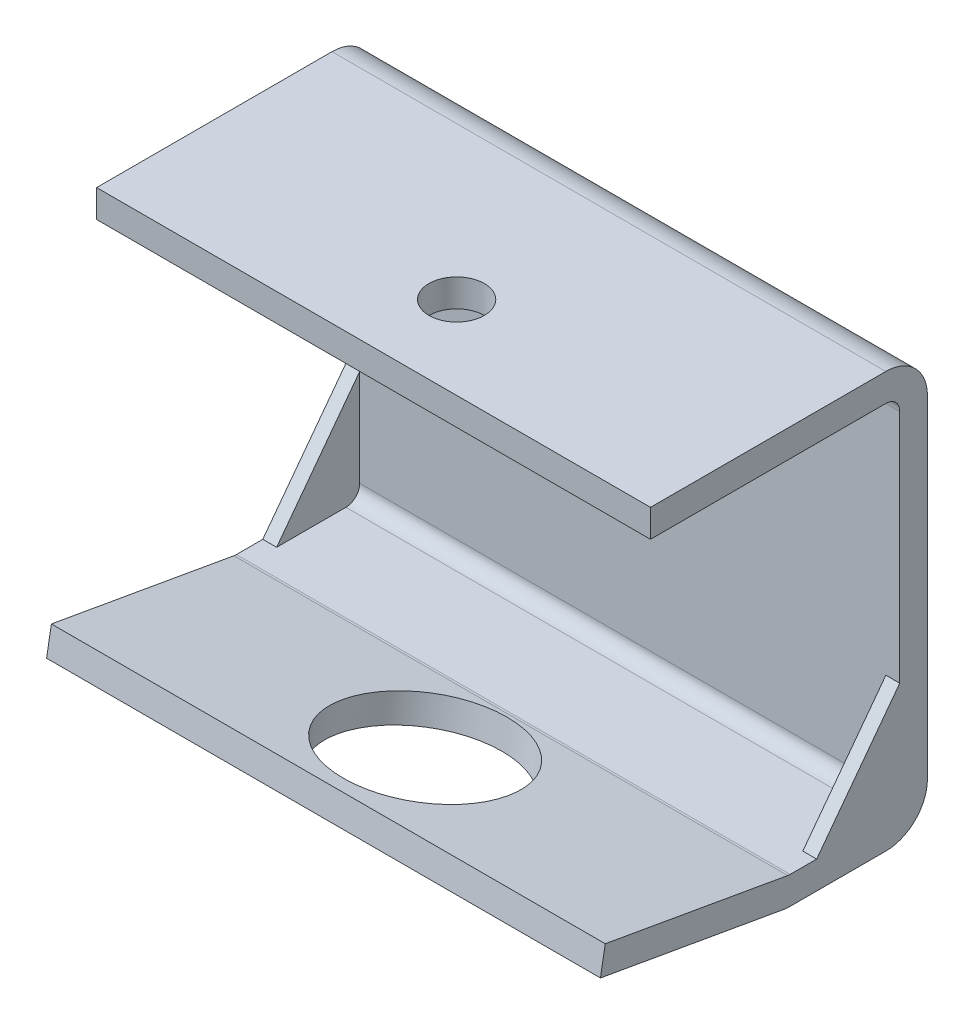
from build123d import *

# Parameters (mm, degrees)
BASE_EXTRUDE_THIN_DEPTH = 63.5
CUT_EXTRUDE1_REACH      = 135.471
SKETCH2_R               = 6.35
BOSS_EXTRUDE1_DEPTH     = 3.175
D_GAGEMENT_00001_D      = 25.4
D_GAGEMENT_00001_DEPTH  = 6.35
D_GAGEMENT_00001_TIP    = 7.630929862
ESQUISSE3_R             = 19.05
ENL_V_MAT_EXTRU_1_DEPTH = 132.649844576


with BuildPart() as part:
    # Sketch1 → Base-Extrude-Thin (new, symmetric)
    with BuildSketch(Plane(origin=(0, 0, 0), x_dir=(0, 0, -1), z_dir=(1, 0, 0))):
        with BuildLine():
            Line((-67.523772904, 7.427557692), (-25.673556457, 0.048235384))
            ThreePointArc((-25.673556457, 0.048235384), (-25.398942977, 0.012081834), (-25.122223493, 0))
            Line((-25.122223493, 0), (-3.175, 0))
            ThreePointArc((-3.175, 0), (-0.92993597, 0.92993597), (0, 3.175))
            Line((0, 3.175), (0, 79.375))
            ThreePointArc((0, 79.375), (-0.92993597, 81.62006403), (-3.175, 82.55))
            Line((-3.175, 82.55), (-57.15, 82.55))
            Line((-57.15, 82.55), (-57.15, 88.9))
            Line((-57.15, 88.9), (-3.175, 88.9))
            ThreePointArc((-3.175, 88.9), (3.560192091, 86.110192091), (6.35, 79.375))
            Line((6.35, 79.375), (6.35, 3.175))
            ThreePointArc((6.35, 3.175), (3.560192091, -3.560192091), (-3.175, -6.35))
            Line((-3.175, -6.35), (-25.122223493, -6.35))
            ThreePointArc((-25.122223493, -6.35), (-25.952381943, -6.313754499), (-26.776222386, -6.205293847))
            Line((-26.776222386, -6.205293847), (-68.626438832, 1.174028461))
            Line((-68.626438832, 1.174028461), (-67.523772904, 7.427557692))
        make_face()
    extrude(amount=BASE_EXTRUDE_THIN_DEPTH, both=True)

    # Sketch2 → Cut-Extrude1 (cut, up to next)
    with BuildSketch(Plane(origin=(0, 88.9, 0), x_dir=(-1, 0, 0), z_dir=(0, 1, 0)), mode=Mode.PRIVATE) as cut_extrude1_sk1:
        with Locations(Location((0, 38.1, 0), (0, 0, 90))):
            Circle(SKETCH2_R)
    cut_extrude1_tool1 = extrude(cut_extrude1_sk1.sketch, amount=-CUT_EXTRUDE1_REACH, mode=Mode.PRIVATE) & part.part
    add(cut_extrude1_tool1.solids().sort_by_distance((0, 88.9, 38.1))[0], mode=Mode.SUBTRACT)

    # Sketch3 → Boss-Extrude1 (add)
    with BuildSketch(Plane(origin=(63.5, 0, 0), x_dir=(0, 0, -1), z_dir=(1, 0, 0))):
        with BuildLine():
            Line((-19.05, 0), (-3.175, 0))
            ThreePointArc((-3.175, 0), (-0.92993597, 0.92993597), (0, 3.175))
            Line((0, 3.175), (0, 25.4))
            Line((0, 25.4), (-19.05, 0))
        make_face()
    boss_extrude1 = extrude(amount=-BOSS_EXTRUDE1_DEPTH)

    # Mirror1: Boss-Extrude1 across plane
    add(boss_extrude1.mirror(Plane(origin=(0, 0, 0), x_dir=(0, 0, 1), z_dir=(1, 0, 0))))

    # Dégagement #00001
    with Locations(Plane(origin=(0, -4.34365582, 0.765903716), x_dir=(-1, 0, 0), z_dir=(0, 0.9848077530122081, -0.17364817766693075))):
        with Locations((-4.206462063, 49.405030417)):
            Hole(D_GAGEMENT_00001_D / 2, depth=D_GAGEMENT_00001_DEPTH)
            with Locations((0, 0, -(D_GAGEMENT_00001_DEPTH + D_GAGEMENT_00001_TIP / 2))):  # 118° drill point
                Cone(0, D_GAGEMENT_00001_D / 2, D_GAGEMENT_00001_TIP, mode=Mode.SUBTRACT)

    # Esquisse3 → Enlèv. mat.-Extru.1 (cut, through all)
    with BuildSketch(Plane(origin=(0, -4.34365582, 0.765903716), x_dir=(1, 0, 0), z_dir=(0, 0.9848077530122081, -0.1736481776669307))):
        with Locations(Location((0, -45.239836887, 0), (0, 0, 270))):
            Circle(ESQUISSE3_R)
    extrude(amount=-ENL_V_MAT_EXTRU_1_DEPTH, mode=Mode.SUBTRACT)


solid = part.part
